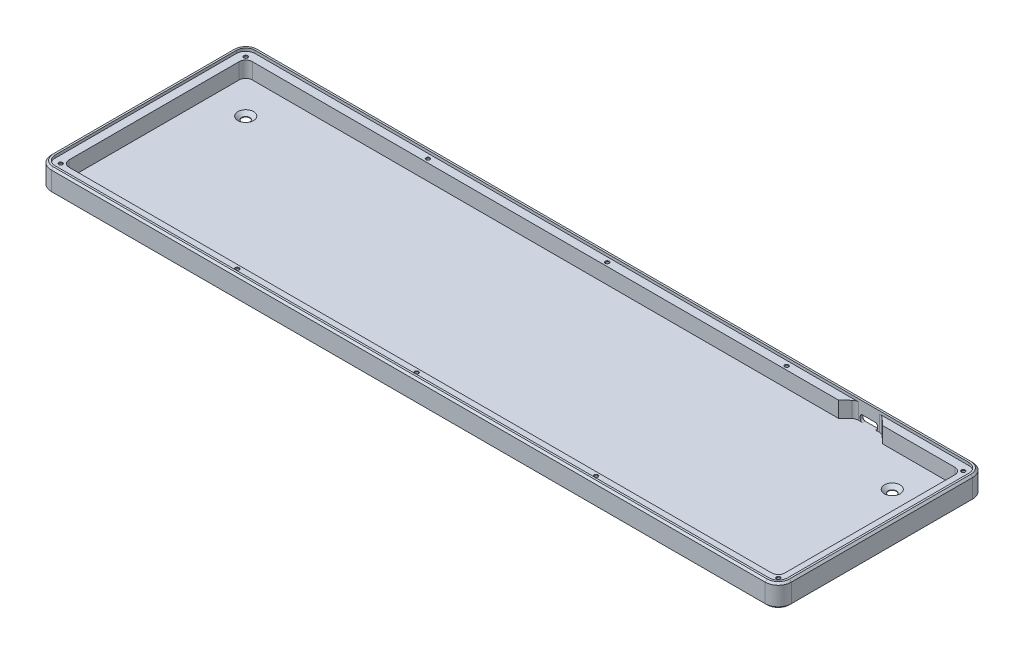
from build123d import *

# Parameters (mm, degrees)
BOSS_EXTRUDE1_DEPTH                            = 12
CUT_EXTRUDE1_DEPTH                             = 1.5
CUT_EXTRUDE2_DEPTH                             = 8.5
M2X0_4_TAPPED_HOLE1_D                          = 1.6
M2X0_4_TAPPED_HOLE1_DEPTH                      = 6
M2X0_4_TAPPED_HOLE1_CSINK_D                    = 2.05
M2X0_4_TAPPED_HOLE1_CSINK_ANGLE                = 90
M2X0_4_TAPPED_HOLE1_TIP                        = 0.480688495
CSK_FOR_M4_FLAT_HEAD_MACHINE_SCREW2_AT_2_COUNT = 2
CSK_FOR_M4_FLAT_HEAD_MACHINE_SCREW2_AT_2_PITCH = 346
CHAMFER1_SIZE                                  = 1
CUT_EXTRUDE3_DEPTH                             = 10
CUT_EXTRUDE4_DEPTH                             = 10
CUT_EXTRUDE5_DEPTH                             = 0.375
CHAMFER3_SIZE                                  = 0.254


with BuildPart() as part:
    # Sketch1 → Boss-Extrude1 (new body)
    with BuildSketch(Plane(origin=(0, 0, 0), x_dir=(1, 0, 0), z_dir=(0, 1, 0))):
        with BuildLine():
            Line((-5, 109), (-387, 109))
            ThreePointArc((-387, 109), (-391.949747468, 106.949747468), (-394, 102))
            Line((-394, 102), (-394, 5))
            ThreePointArc((-394, 5), (-391.949747468, 0.050252532), (-387, -2))
            Line((-387, -2), (-5, -2))
            ThreePointArc((-5, -2), (-0.050252532, 0.050252532), (2, 5))
            Line((2, 5), (2, 102))
            ThreePointArc((2, 102), (-0.050252532, 106.949747468), (-5, 109))
        make_face()
    extrude(amount=BOSS_EXTRUDE1_DEPTH)

    # Sketch2 → Cut-Extrude1 (cut)
    with BuildSketch(Plane(origin=(0, 12, 0), x_dir=(1, 0, 0), z_dir=(0, 1, 0))):
        with BuildLine():
            Line((0, 5), (0, 102))
            ThreePointArc((0, 102), (-1.464466094, 105.535533906), (-5, 107))
            Line((-5, 107), (-387, 107))
            ThreePointArc((-387, 107), (-390.535533906, 105.535533906), (-392, 102))
            Line((-392, 102), (-392, 5))
            ThreePointArc((-392, 5), (-390.535533906, 1.464466094), (-387, 0))
            Line((-387, 0), (-5, 0))
            ThreePointArc((-5, 0), (-1.464466094, 1.464466094), (0, 5))
        make_face()
    extrude(amount=-CUT_EXTRUDE1_DEPTH, mode=Mode.SUBTRACT)

    # Sketch3 → Cut-Extrude2 (cut)
    with BuildSketch(Plane(origin=(0, 10.5, 0), x_dir=(1, 0, 0), z_dir=(0, 1, 0))):
        with BuildLine():
            Line((-384, 102.5), (-8, 102.5))
            ThreePointArc((-8, 102.5), (-5.525126266, 101.474873734), (-4.5, 99))
            Line((-4.5, 99), (-4.5, 8))
            ThreePointArc((-4.5, 8), (-5.525126266, 5.525126266), (-8, 4.5))
            Line((-8, 4.5), (-384, 4.5))
            ThreePointArc((-384, 4.5), (-386.474873734, 5.525126266), (-387.5, 8))
            Line((-387.5, 8), (-387.5, 99))
            ThreePointArc((-387.5, 99), (-386.474873734, 101.474873734), (-384, 102.5))
        make_face()
    extrude(amount=-CUT_EXTRUDE2_DEPTH, mode=Mode.SUBTRACT)

    # M2x0.4 Tapped Hole1
    with Locations(Plane(origin=(-388, 10.5, -103), x_dir=(0, 0, 1), z_dir=(0, 1, 0))):
        with Locations((0, 0), (-1.5, 96), (-1.5, 192), (-1.5, 288), (0, 384), (99, 384), (100.5, 288), (100.5, 192), (100.5, 96), (99, 0)):
            CounterSinkHole(M2X0_4_TAPPED_HOLE1_D / 2, M2X0_4_TAPPED_HOLE1_CSINK_D / 2, depth=M2X0_4_TAPPED_HOLE1_DEPTH, counter_sink_angle=M2X0_4_TAPPED_HOLE1_CSINK_ANGLE)
            with Locations((0, 0, -(M2X0_4_TAPPED_HOLE1_DEPTH + M2X0_4_TAPPED_HOLE1_TIP / 2))):  # 118° drill point
                Cone(0, M2X0_4_TAPPED_HOLE1_D / 2, M2X0_4_TAPPED_HOLE1_TIP, mode=Mode.SUBTRACT)

    # Sketch19 → CSK for M4 Flat Head Machine Screw2 (revolve, cut)
    with BuildSketch(Plane(origin=(-369, 2, -84), x_dir=(0, 0, 1), z_dir=(1, 0, 0))):
        Polygon((0, 0), (0, 2), (2.15, 2), (2.15, 1.709665499), (4.1875, 0), align=None)
    csk_for_m4_flat_head_machine_screw2 = revolve(axis=Axis((-369, 8.35, -84), (0, -1, 0)), mode=Mode.SUBTRACT)

    # CSK for M4 Flat Head Machine Screw2 at 2: CSK for M4 Flat Head Machine Screw2 ×2
    with Locations(*[(i * CSK_FOR_M4_FLAT_HEAD_MACHINE_SCREW2_AT_2_PITCH, 0, 0) for i in range(1, CSK_FOR_M4_FLAT_HEAD_MACHINE_SCREW2_AT_2_COUNT)]):
        add(csk_for_m4_flat_head_machine_screw2, mode=Mode.SUBTRACT)

    # Chamfer1
    chamfer1_edges = [part.edges().sort_by_distance(p)[0] for p in [
        (-391.949747468, 12, -106.949747468),
        (-196, 0, -109),
        (-0.050252532, 0, -106.949747468),
        (-394, 12, -53.5),
        (-391.949747468, 12, -0.050252532),
        (-196, 12, 2),
        (-0.050252532, 12, -0.050252532),
        (2, 12, -53.5),
        (-0.050252532, 12, -106.949747468),
        (-196, 12, -109),
        (2, 0, -53.5),
        (-0.050252532, 0, -0.050252532),
        (-196, 0, 2),
        (-391.949747468, 0, -0.050252532),
        (-394, 0, -53.5),
        (-391.949747468, 0, -106.949747468),
    ]]
    chamfer(chamfer1_edges, length=CHAMFER1_SIZE)

    # Sketch20 → Cut-Extrude3 (cut)
    with BuildSketch(Plane(origin=(0, 2, 0), x_dir=(1, 0, 0), z_dir=(0, 1, 0))):
        with BuildLine():
            Line((-45.6072, 101.5), (-50.491454659, 106.058681888))
            ThreePointArc((-50.491454659, 106.058681888), (-51.596106449, 106.756177714), (-52.879580912, 107))
            Line((-52.879580912, 107), (-64.120419088, 107))
            ThreePointArc((-64.120419088, 107), (-65.403893551, 106.756177714), (-66.508545341, 106.058681888))
            Line((-66.508545341, 106.058681888), (-71.3928, 101.5))
            Line((-71.3928, 101.5), (-45.6072, 101.5))
        make_face()
    extrude(amount=CUT_EXTRUDE3_DEPTH, mode=Mode.SUBTRACT)

    # Sketch21 → Cut-Extrude4 (cut)
    with BuildSketch(Plane(origin=(0, 0, -109), x_dir=(-1, 0, 0), z_dir=(0, 0, -1))):
        with BuildLine():
            Line((55.100019088, 5.5), (61.900019088, 5.5))
            ThreePointArc((61.900019088, 5.5), (62.783902564, 5.133883476), (63.150019088, 4.25))
            Line((63.150019088, 4.25), (63.150019088, 3.25))
            ThreePointArc((63.150019088, 3.25), (62.783902564, 2.366116524), (61.900019088, 2))
            Line((61.900019088, 2), (55.100019088, 2))
            ThreePointArc((55.100019088, 2), (54.216135611, 2.366116524), (53.850019088, 3.25))
            Line((53.850019088, 3.25), (53.850019088, 4.25))
            ThreePointArc((53.850019088, 4.25), (54.216135611, 5.133883476), (55.100019088, 5.5))
        make_face()
    extrude(amount=-CUT_EXTRUDE4_DEPTH, mode=Mode.SUBTRACT)

    # Sketch22 → Cut-Extrude5 (cut)
    with BuildSketch(Plane(origin=(0, 0, -109), x_dir=(-1, 0, 0), z_dir=(0, 0, -1))):
        with BuildLine():
            Line((51.500019088, -6.125), (51.500019088, 4.7))
            ThreePointArc((51.500019088, 4.7), (52.429955058, 6.94506403), (54.675019088, 7.875))
            Line((54.675019088, 7.875), (62.325019088, 7.875))
            ThreePointArc((62.325019088, 7.875), (64.570083118, 6.94506403), (65.500019088, 4.7))
            Line((65.500019088, 4.7), (65.500019088, -6.125))
            Line((65.500019088, -6.125), (51.500019088, -6.125))
        make_face()
    extrude(amount=-CUT_EXTRUDE5_DEPTH, mode=Mode.SUBTRACT)

    # Chamfer3
    chamfer3_edges = [part.edges().sort_by_distance(p)[0] for p in [
        (-54.216135611, 2.366116524, -108.625),
        (-58.500019088, 5.5, -108.625),
        (-54.216135611, 5.133883476, -108.625),
        (-53.850019088, 3.75, -108.625),
        (-58.500019088, 2, -108.625),
        (-62.783902564, 2.366116524, -108.625),
        (-63.150019088, 3.75, -108.625),
        (-62.783902564, 5.133883476, -108.625),
    ]]
    chamfer(chamfer3_edges, length=CHAMFER3_SIZE)


solid = part.part
